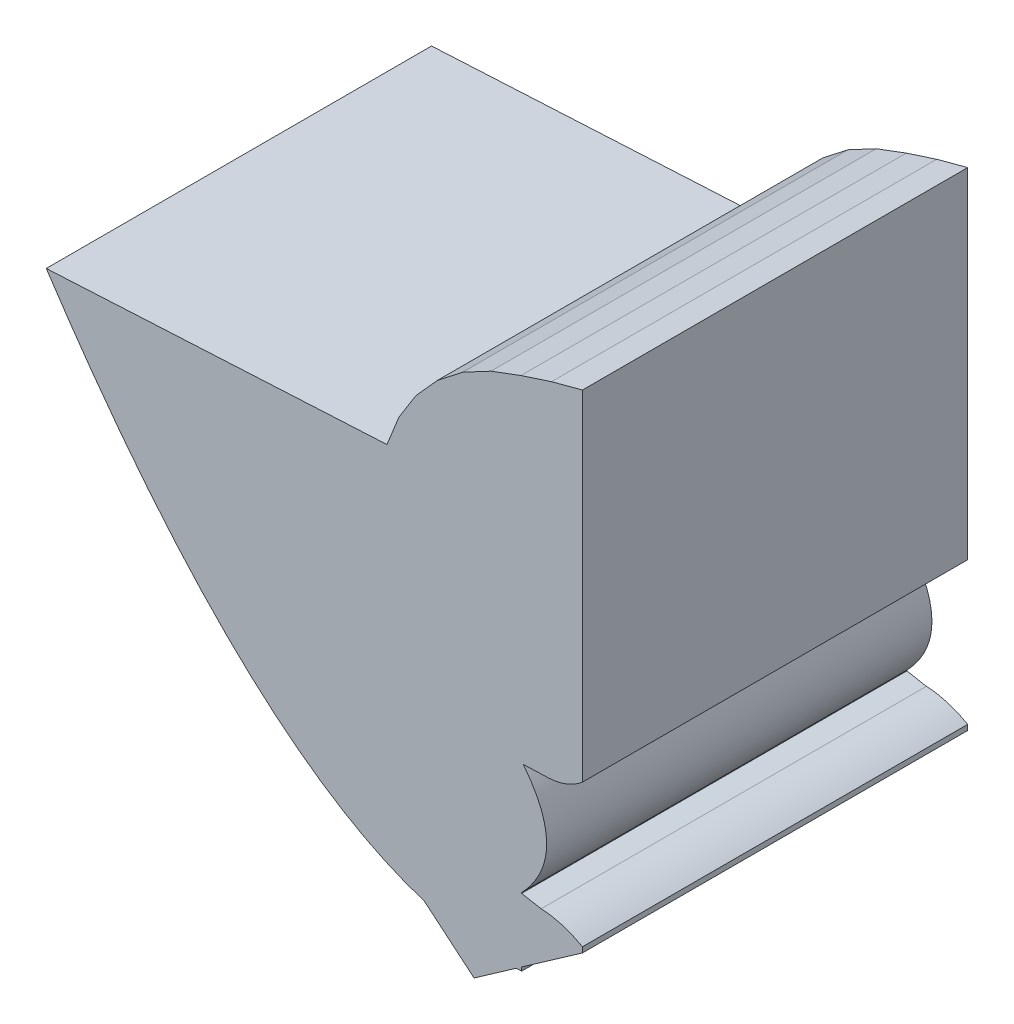
from build123d import *

# Parameters (mm, degrees)
CROQUIS_BASE_DEPTH              = 7.21
LENTE_PPAL_1_REACH              = 29.232
LENTE_PPAL_1_DIRECTION_2_REACH  = 29.232
LENTE_PPAL_2_DEPTH              = 28.232395361
LENTE_PPAL_2_DEPTH_BACK         = 28.232395361
CROQUIS9_3_OUTSIDE_W            = 30.105
CROQUIS9_3_OUTSIDE_H            = 25.977
LENTE_FRONTAL_REACH             = 25.468
LENTE_FRONTAL_DIRECTION_2_REACH = 25.468
LENTE_TRASERA_REACH             = 28.339
LENTE_TRASERA_DIRECTION_2_REACH = 28.339


with BuildPart() as part:
    # Croquis1 → croquis base (new, symmetric)
    with BuildSketch(Plane.XY):
        with BuildLine():
            Line((-8.981845695, 12.608155172), (-23.035921146, 11.871612288))
            Line((-23.035921146, 11.871612288), (-23.035921146, 11.54013782))
            ThreePointArc((-23.035921146, 11.54013782), (-20.949684518, 9.582335705), (-18.945192114, 7.540918896))
            add(Edge.make_bspline(
                [(-18.945192114, 7.540918896), (-10.215008384, -3.697644103), (-2.846604825, -5.059081104)],
                knots=[0.497667241, 0.497667241, 0.497667241, 0.49955428, 0.49955428, 0.49955428], degree=2, weights=[1, 1, 1]))
            add(Edge.make_bspline(
                [(-2.846604825, -5.059081104), (-2.498165198, -4.87297933), (-2.177330418, -4.684462446)],
                knots=[0.498812075, 0.498812075, 0.498812075, 0.498911556, 0.498911556, 0.498911556], degree=2, weights=[1, 1, 1]))
            Line((-2.177330418, -4.684462446), (-2.177330418, 6.186438919))
            add(Edge.make_bspline(
                [(-2.177330418, 6.186438919), (-4.063319702, 8.141636997), (-6.994875026, 10.477389992)],
                knots=[0.50138293, 0.50138293, 0.50138293, 0.502013312, 0.502013312, 0.502013312], degree=2, weights=[1, 1, 1]))
            Line((-6.994875026, 10.477389992), (-8.981845695, 12.608155172))
        make_face()
    extrude(amount=CROQUIS_BASE_DEPTH, both=True)

    # lente ppal 1: up to this face of the body (flat: up to its plane)
    lente_ppal_1_end = Plane(part.part.faces().sort_by_distance((-10.153546236, 5.159655325, 7.21))[0])
    # Croquis9 → lente ppal 1 (add, up to the picked face)
    with BuildSketch(Plane.XY, mode=Mode.PRIVATE) as lente_ppal_1_sk1:
        with BuildLine():
            add(Edge.make_bspline(
                [(-2.177330418, -4.388282022), (-10.4130765, -4.994158739), (-19.969359014, 9.493765032)],
                knots=[0, 0, 0, 1, 1, 1], degree=2))
            Line((-19.969359014, 9.493765032), (-10.309820395, 10))
            Line((-10.309820395, 10), (-2.177330418, 6.082860828))
            Line((-2.177330418, 6.082860828), (-2.177330418, 2.424232079))
            add(Edge.make_bspline(
                [(-2.177330418, 2.424232079), (-0.304369247, 0.128042884), (-2.177330418, -1.840420572)],
                knots=[0, 0, 0, 1, 1, 1], degree=2))
            Line((-2.177330418, -1.840420572), (-2.177330418, -4.388282022))
        make_face()
    lente_ppal_1_tool1 = split(extrude(lente_ppal_1_sk1.sketch, amount=LENTE_PPAL_1_REACH, mode=Mode.PRIVATE), bisect_by=lente_ppal_1_end, keep=Keep.BOTH, mode=Mode.PRIVATE)
    add(lente_ppal_1_tool1.solids().sort_by(Axis((-9.106368, 3.599172, 0), (0, 0, 1)))[0])

    # lente ppal 1 direction 2: up to this face of the body (flat: up to its plane)
    lente_ppal_1_direction_2_end = Plane(part.part.faces().sort_by_distance((-10.153546236, 5.159655325, -7.21))[0])
    # Croquis9 → lente ppal 1 direction 2 (add, up to the picked face)
    with BuildSketch(Plane.XY, mode=Mode.PRIVATE) as lente_ppal_1_direction_2_sk1:
        with BuildLine():
            add(Edge.make_bspline(
                [(-2.177330418, -4.388282022), (-10.4130765, -4.994158739), (-19.969359014, 9.493765032)],
                knots=[0, 0, 0, 1, 1, 1], degree=2))
            Line((-19.969359014, 9.493765032), (-10.309820395, 10))
            Line((-10.309820395, 10), (-2.177330418, 6.082860828))
            Line((-2.177330418, 6.082860828), (-2.177330418, 2.424232079))
            add(Edge.make_bspline(
                [(-2.177330418, 2.424232079), (-0.304369247, 0.128042884), (-2.177330418, -1.840420572)],
                knots=[0, 0, 0, 1, 1, 1], degree=2))
            Line((-2.177330418, -1.840420572), (-2.177330418, -4.388282022))
        make_face()
    lente_ppal_1_direction_2_tool1 = split(extrude(lente_ppal_1_direction_2_sk1.sketch, amount=-LENTE_PPAL_1_DIRECTION_2_REACH, mode=Mode.PRIVATE), bisect_by=lente_ppal_1_direction_2_end, keep=Keep.BOTH, mode=Mode.PRIVATE)
    add(lente_ppal_1_direction_2_tool1.solids().sort_by(Axis((-9.106368, 3.599172, 0), (0, 0, -1)))[0])

    # Croquis9<3> outside → lente ppal 2 (cut, two sides: drawn at the far end of the back side and taken through both)
    with BuildSketch(Plane.XY.offset(-LENTE_PPAL_2_DEPTH_BACK)):
        with Locations((-12.1385, 3.7745)):
            Rectangle(CROQUIS9_3_OUTSIDE_W, CROQUIS9_3_OUTSIDE_H)
        with BuildLine():
            Line((-2.177330418, -1.840420572), (-2.177330418, -4.388282022))
            add(Edge.make_bspline(
                [(-2.177330418, -4.388282022), (-10.4130765, -4.994158739), (-19.969359014, 9.493765032)],
                knots=[0, 0, 0, 1, 1, 1], degree=2))
            Line((-19.969359014, 9.493765032), (-10.309820395, 10))
            Line((-10.309820395, 10), (-2.177330418, 6.082860828))
            Line((-2.177330418, 6.082860828), (-2.177330418, 2.424232079))
            add(Edge.make_bspline(
                [(-2.177330418, 2.424232079), (-0.304369247, 0.128042884), (-2.177330418, -1.840420572)],
                knots=[0, 0, 0, 1, 1, 1], degree=2))
        make_face(mode=Mode.SUBTRACT)
    extrude(amount=LENTE_PPAL_2_DEPTH + LENTE_PPAL_2_DEPTH_BACK, mode=Mode.SUBTRACT)

    # lente frontal: up to this face of the body (flat: up to its plane)
    lente_frontal_end = Plane(part.part.faces().sort_by_distance((-9.106367081, 3.599171888, 7.21))[0])
    # Croquis8 → lente frontal (add, up to the picked face)
    with BuildSketch(Plane.XY, mode=Mode.PRIVATE) as lente_frontal_sk1:
        with BuildLine():
            Line((0.1, 2.877673418), (0.1, 15.587903347))
            Line((0.1, 15.587903347), (-1.059110992, 15.277320493))
            Line((-1.059110992, 15.277320493), (-2.200378811, 14.9065001))
            Line((-2.200378811, 14.9065001), (-3.324385438, 14.486251242))
            Line((-3.324385438, 14.486251242), (-4.38392255, 13.922885367))
            Line((-4.38392255, 13.922885367), (-5.329535454, 13.184091597))
            Line((-5.329535454, 13.184091597), (-6.132492182, 12.292317806))
            Line((-6.132492182, 12.292317806), (-6.768395299, 11.274660091))
            Line((-6.768395299, 11.274660091), (-7.217923211, 10.162039465))
            Line((-7.217923211, 10.162039465), (-10.309820395, 10))
            Line((-10.309820395, 10), (-2.177330418, 2.342487007))
            Line((-2.177330418, 2.342487007), (-1.190501641, 2.376947827))
            add(Edge.make_bspline(
                [(-1.190501641, 2.376947827), (-0.463368169, 2.402339888), (0.1, 2.877673418)],
                knots=[0, 0, 0, 1, 1, 1], degree=2))
        make_face()
    lente_frontal_tool1 = split(extrude(lente_frontal_sk1.sketch, amount=LENTE_FRONTAL_REACH, mode=Mode.PRIVATE), bisect_by=lente_frontal_end, keep=Keep.BOTH, mode=Mode.PRIVATE)
    add(lente_frontal_tool1.solids().sort_by(Axis((-3.290182, 8.96302, 0), (0, 0, 1)))[0])

    # lente frontal direction 2: up to this face of the body (flat: up to its plane)
    lente_frontal_direction_2_end = Plane(part.part.faces().sort_by_distance((-9.106367081, 3.599171888, -7.21))[0])
    # Croquis8 → lente frontal direction 2 (add, up to the picked face)
    with BuildSketch(Plane.XY, mode=Mode.PRIVATE) as lente_frontal_direction_2_sk1:
        with BuildLine():
            Line((0.1, 2.877673418), (0.1, 15.587903347))
            Line((0.1, 15.587903347), (-1.059110992, 15.277320493))
            Line((-1.059110992, 15.277320493), (-2.200378811, 14.9065001))
            Line((-2.200378811, 14.9065001), (-3.324385438, 14.486251242))
            Line((-3.324385438, 14.486251242), (-4.38392255, 13.922885367))
            Line((-4.38392255, 13.922885367), (-5.329535454, 13.184091597))
            Line((-5.329535454, 13.184091597), (-6.132492182, 12.292317806))
            Line((-6.132492182, 12.292317806), (-6.768395299, 11.274660091))
            Line((-6.768395299, 11.274660091), (-7.217923211, 10.162039465))
            Line((-7.217923211, 10.162039465), (-10.309820395, 10))
            Line((-10.309820395, 10), (-2.177330418, 2.342487007))
            Line((-2.177330418, 2.342487007), (-1.190501641, 2.376947827))
            add(Edge.make_bspline(
                [(-1.190501641, 2.376947827), (-0.463368169, 2.402339888), (0.1, 2.877673418)],
                knots=[0, 0, 0, 1, 1, 1], degree=2))
        make_face()
    lente_frontal_direction_2_tool1 = split(extrude(lente_frontal_direction_2_sk1.sketch, amount=-LENTE_FRONTAL_DIRECTION_2_REACH, mode=Mode.PRIVATE), bisect_by=lente_frontal_direction_2_end, keep=Keep.BOTH, mode=Mode.PRIVATE)
    add(lente_frontal_direction_2_tool1.solids().sort_by(Axis((-3.290182, 8.96302, 0), (0, 0, -1)))[0])

    # lente trasera: up to this face of the body (flat: up to its plane)
    lente_trasera_end = Plane(part.part.faces().sort_by_distance((-7.357064552, 5.305385386, 7.21))[0])
    # Croquis11 → lente trasera (add, up to the picked face)
    with BuildSketch(Plane.XY, mode=Mode.PRIVATE) as lente_trasera_sk1:
        with BuildLine():
            Line((0.1, -2.458811066), (0.1, -2.658811066))
            Line((0.1, -2.658811066), (-3.957638313, -5.5))
            Line((-3.957638313, -5.5), (-10.029650265, -0.404977011))
            Line((-10.029650265, -0.404977011), (-1.447650757, -2.001370848))
            add(Edge.make_bspline(
                [(-1.447650757, -2.001370848), (-0.67030688, -2.028516294), (0.1, -2.458811066)],
                knots=[0, 0, 0, 1, 1, 1], degree=2))
        make_face()
    lente_trasera_tool1 = split(extrude(lente_trasera_sk1.sketch, amount=LENTE_TRASERA_REACH, mode=Mode.PRIVATE), bisect_by=lente_trasera_end, keep=Keep.BOTH, mode=Mode.PRIVATE)
    add(lente_trasera_tool1.solids().sort_by(Axis((-4.514125, -2.758798, 0), (0, 0, 1)))[0])

    # lente trasera direction 2: up to this face of the body (flat: up to its plane)
    lente_trasera_direction_2_end = Plane(part.part.faces().sort_by_distance((-7.357064552, 5.305385386, -7.21))[0])
    # Croquis11 → lente trasera direction 2 (add, up to the picked face)
    with BuildSketch(Plane.XY, mode=Mode.PRIVATE) as lente_trasera_direction_2_sk1:
        with BuildLine():
            Line((0.1, -2.458811066), (0.1, -2.658811066))
            Line((0.1, -2.658811066), (-3.957638313, -5.5))
            Line((-3.957638313, -5.5), (-10.029650265, -0.404977011))
            Line((-10.029650265, -0.404977011), (-1.447650757, -2.001370848))
            add(Edge.make_bspline(
                [(-1.447650757, -2.001370848), (-0.67030688, -2.028516294), (0.1, -2.458811066)],
                knots=[0, 0, 0, 1, 1, 1], degree=2))
        make_face()
    lente_trasera_direction_2_tool1 = split(extrude(lente_trasera_direction_2_sk1.sketch, amount=-LENTE_TRASERA_DIRECTION_2_REACH, mode=Mode.PRIVATE), bisect_by=lente_trasera_direction_2_end, keep=Keep.BOTH, mode=Mode.PRIVATE)
    add(lente_trasera_direction_2_tool1.solids().sort_by(Axis((-4.514125, -2.758798, 0), (0, 0, -1)))[0])


solid = part.part
